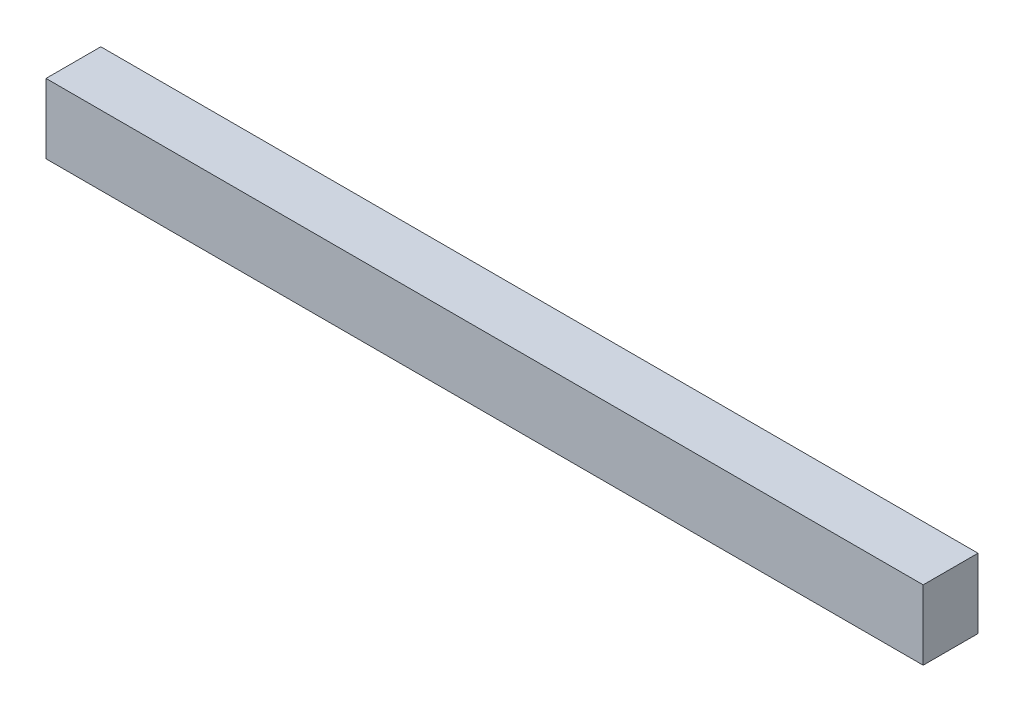
from build123d import *

# Parameters (mm, degrees)
SKETCH1_W           = 80
SKETCH1_H           = 5
BOSS_EXTRUDE1_DEPTH = 6.35


with BuildPart() as part:
    # Sketch1 → Boss-Extrude1 (new body)
    with BuildSketch(Plane(origin=(0, 0, 0), x_dir=(1, 0, 0), z_dir=(0, 1, 0))):
        Rectangle(SKETCH1_W, SKETCH1_H)
    extrude(amount=BOSS_EXTRUDE1_DEPTH)


solid = part.part
